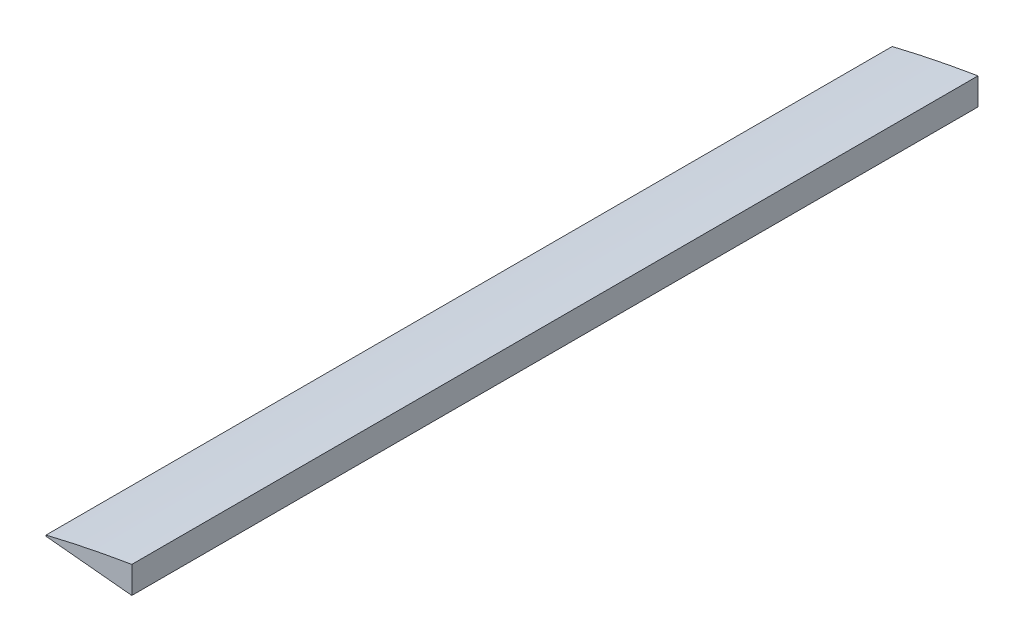
from build123d import *

# Parameters (mm, degrees)
BOSS_EXTRUDE1_DEPTH = 612


with BuildPart() as part:
    # Sketch1 → Boss-Extrude1 (new body)
    with BuildSketch(Plane.XY):
        with BuildLine():
            Line((-176.6195, 13.023106532), (-176.6195, -6.454370506))
            add(Edge.make_bspline(
                [(-176.6195, -6.454370506), (-178.188753482, -6.312108504), (-182.359886546, -5.933970906), (-188.990421054, -5.317886092), (-196.354680808, -4.624175058), (-203.248712282, -3.963626977), (-209.62869232, -3.342836229), (-215.453758548, -2.767226084), (-220.686424709, -2.242558309), (-225.292785947, -1.773651832), (-229.242958683, -1.367494124), (-232.510834876, -1.023880308), (-235.075678546, -0.760955177), (-236.918777596, -0.548714441), (-238.031628616, -0.459131063), (-238.533564191, -0.37457711), (-238.666663293, -0.375050863), (-238.675, -0.375080537)],
                knots=[0, 0, 0, 0, 0.075810952, 0.201508279, 0.320388141, 0.43169539, 0.534719075, 0.628797147, 0.713321079, 0.787740393, 0.851567051, 0.904379655, 0.945827345, 0.975633259, 0.993597432, 0.999598973, 1, 1, 1, 1], degree=3))
            Line((-238.675, -0.375080537), (-238.675, 0.381187438))
            add(Edge.make_bspline(
                [(-176.6195, 13.023106532), (-178.431906242, 12.722514089), (-182.841851447, 11.991112834), (-189.692146989, 10.770798), (-197.014934224, 9.410710515), (-203.85370055, 8.079649627), (-210.168190111, 6.800350463), (-215.920851847, 5.591313194), (-221.077844998, 4.471477539), (-225.608999593, 3.458735797), (-229.487989995, 2.569844864), (-232.692417393, 1.819938109), (-235.203893789, 1.222163619), (-237.008061317, 0.787162185), (-238.08635023, 0.525005253), (-238.562115977, 0.408767052), (-238.675, 0.381187438)],
                knots=[0, 0, 0, 0, 0.087007005, 0.211705365, 0.329527113, 0.439740645, 0.541660709, 0.634652346, 0.718134669, 0.791584505, 0.854539888, 0.906603358, 0.947445002, 0.976805146, 0.994496602, 1, 1, 1, 1], degree=3))
        make_face()
    extrude(amount=-BOSS_EXTRUDE1_DEPTH)


solid = part.part
